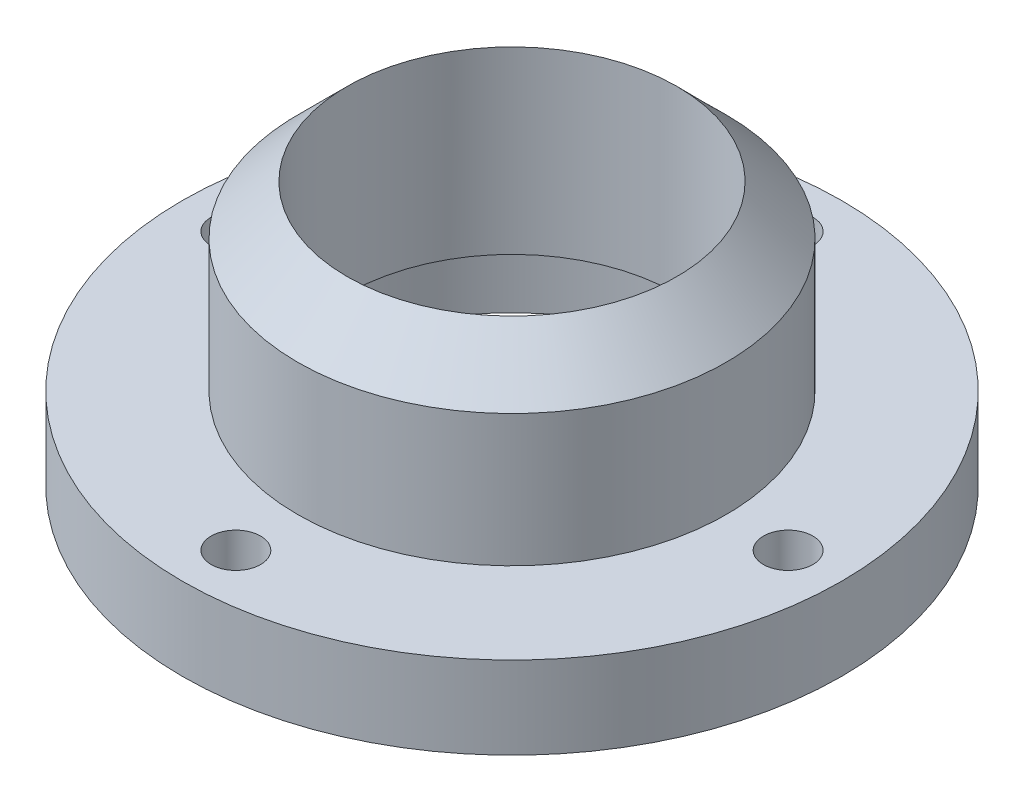
from build123d import *

# Parameters (mm, degrees)
SKETCH1_R           = 40
BOSS_EXTRUDE1_DEPTH = 10
SKETCH2_R           = 3
CUT_EXTRUDE1_DEPTH  = 195.477983176
SKETCH3_R           = 3
CUT_EXTRUDE2_DEPTH  = 195.477983176
SKETCH4_R           = 3
CUT_EXTRUDE3_DEPTH  = 195.477983176
SKETCH5_R           = 3
CUT_EXTRUDE4_DEPTH  = 195.477983176
SKETCH6_R           = 26
BOSS_EXTRUDE2_DEPTH = 16
SKETCH7_R           = 26
BOSS_EXTRUDE3_DEPTH = 6
BOSS_EXTRUDE3_TAPER = 45
SKETCH8_R           = 20
BOSS_EXTRUDE4_DEPTH = 14
SKETCH9_R           = 25.75
CUT_EXTRUDE5_DEPTH  = 10.2
SKETCH10_R          = 20
CUT_EXTRUDE6_DEPTH  = 198.492597178


with BuildPart() as part:
    # Sketch1 → Boss-Extrude1 (new body)
    with BuildSketch(Plane.XZ.offset(-11.5)):
        with Locations(Location((-150.057059695, 0, 0), (0, 0, 90))):
            Circle(SKETCH1_R)
    extrude(amount=-BOSS_EXTRUDE1_DEPTH)

    # Sketch2 → Cut-Extrude1 (cut, through all)
    with BuildSketch(Plane.XZ.offset(-11.5)):
        with Locations(Location((-150.057059695, -33.5, 0), (0, 0, 90))):
            Circle(SKETCH2_R)
    extrude(amount=-CUT_EXTRUDE1_DEPTH, mode=Mode.SUBTRACT)

    # Sketch3 → Cut-Extrude2 (cut, through all)
    with BuildSketch(Plane.XZ.offset(-11.5)):
        with Locations(Location((-116.557059695, 0, 0), (0, 0, 90))):
            Circle(SKETCH3_R)
    extrude(amount=-CUT_EXTRUDE2_DEPTH, mode=Mode.SUBTRACT)

    # Sketch4 → Cut-Extrude3 (cut, through all)
    with BuildSketch(Plane.XZ.offset(-11.5)):
        with Locations(Location((-150.057059695, 33.5, 0), (0, 0, 90))):
            Circle(SKETCH4_R)
    extrude(amount=-CUT_EXTRUDE3_DEPTH, mode=Mode.SUBTRACT)

    # Sketch5 → Cut-Extrude4 (cut, through all)
    with BuildSketch(Plane(origin=(0, 21.5, 0), x_dir=(-1, 0, 0), z_dir=(0, 1, 0))):
        with Locations(Location((183.557059695, 0, 0), (0, 0, 270))):
            Circle(SKETCH5_R)
    extrude(amount=-CUT_EXTRUDE4_DEPTH, mode=Mode.SUBTRACT)

    # Sketch6 → Boss-Extrude2 (add)
    with BuildSketch(Plane(origin=(0, 21.5, 0), x_dir=(-1, 0, 0), z_dir=(0, 1, 0))):
        with Locations(Location((150.057059695, 0, 0), (0, 0, 90))):
            Circle(SKETCH6_R)
    extrude(amount=BOSS_EXTRUDE2_DEPTH)

    # Sketch7 → Boss-Extrude3 (add)
    with BuildSketch(Plane(origin=(0, 37.5, 0), x_dir=(-1, 0, 0), z_dir=(0, 1, 0))):
        with Locations(Location((150.057059695, 0, 0), (0, 0, 90))):
            Circle(SKETCH7_R)
    extrude(amount=BOSS_EXTRUDE3_DEPTH, taper=BOSS_EXTRUDE3_TAPER)

    # Sketch8 → Boss-Extrude4 (add)
    with BuildSketch(Plane(origin=(0, 43.5, 0), x_dir=(-1, 0, 0), z_dir=(0, 1, 0))):
        with Locations(Location((150.057059695, 0, 0), (0, 0, 90))):
            Circle(SKETCH8_R)
    extrude(amount=BOSS_EXTRUDE4_DEPTH)

    # Sketch9 → Cut-Extrude5 (cut)
    with BuildSketch(Plane.XZ.offset(-11.5)):
        with Locations(Location((-150.057059695, 0, 0), (0, 0, 90))):
            Circle(SKETCH9_R)
    extrude(amount=-CUT_EXTRUDE5_DEPTH, mode=Mode.SUBTRACT)

    # Sketch10 → Cut-Extrude6 (cut, through all)
    with BuildSketch(Plane.XZ.offset(-21.7)):
        with Locations(Location((-150.057059695, 0, 0), (0, 0, 270))):
            Circle(SKETCH10_R)
    extrude(amount=-CUT_EXTRUDE6_DEPTH, mode=Mode.SUBTRACT)


solid = part.part
